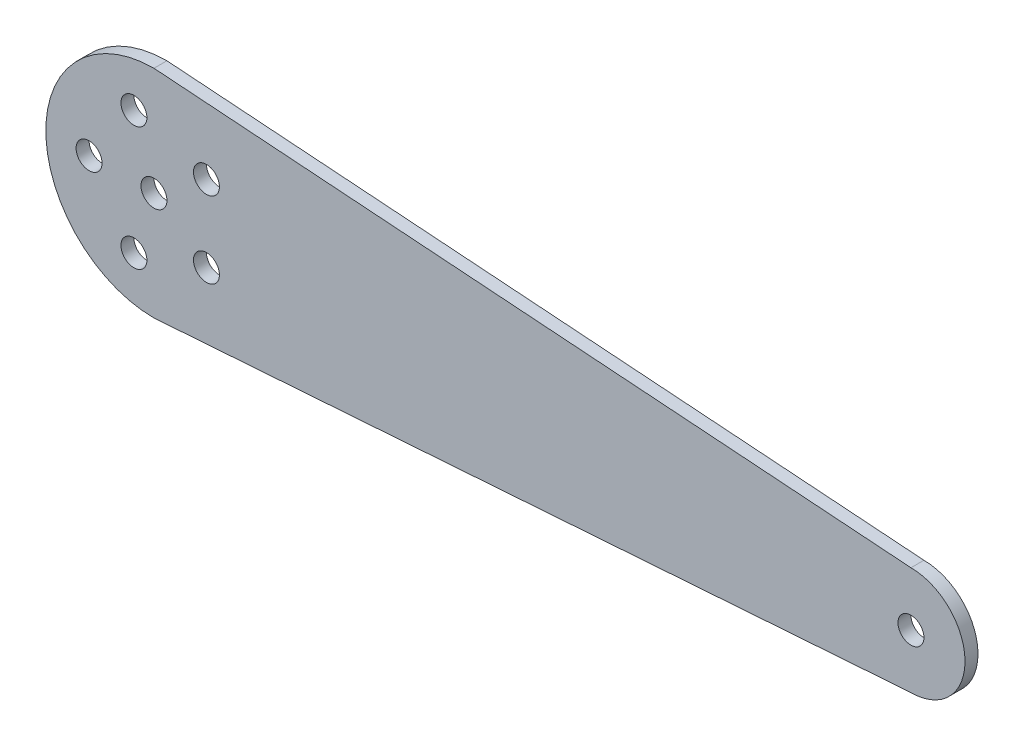
from build123d import *

# Parameters (mm, degrees)
SKETCH4_R           = 3
BOSS_EXTRUDE1_DEPTH = 3


with BuildPart() as part:
    # Sketch4 → Boss-Extrude1 (new body)
    with BuildSketch(Plane.XY):
        with BuildLine():
            Line((0, 25), (175, 12.5))
            ThreePointArc((175, 12.5), (187.5, 0), (175, -12.5))
            Line((175, -12.5), (0, -25))
            ThreePointArc((0, -25), (-25, 0), (0, 25))
        make_face()
        Circle(SKETCH4_R, mode=Mode.SUBTRACT)
        with Locations((175, 0)):
            Circle(SKETCH4_R, mode=Mode.SUBTRACT)
        with Locations((-15, 0)):
            Circle(SKETCH4_R, mode=Mode.SUBTRACT)
        with Locations((-4.635254916, 14.265847744)):
            Circle(SKETCH4_R, mode=Mode.SUBTRACT)
        with Locations((12.135254916, 8.816778784)):
            Circle(SKETCH4_R, mode=Mode.SUBTRACT)
        with Locations((12.135254916, -8.816778784)):
            Circle(SKETCH4_R, mode=Mode.SUBTRACT)
        with Locations((-4.635254916, -14.265847744)):
            Circle(SKETCH4_R, mode=Mode.SUBTRACT)
    extrude(amount=BOSS_EXTRUDE1_DEPTH)


solid = part.part
